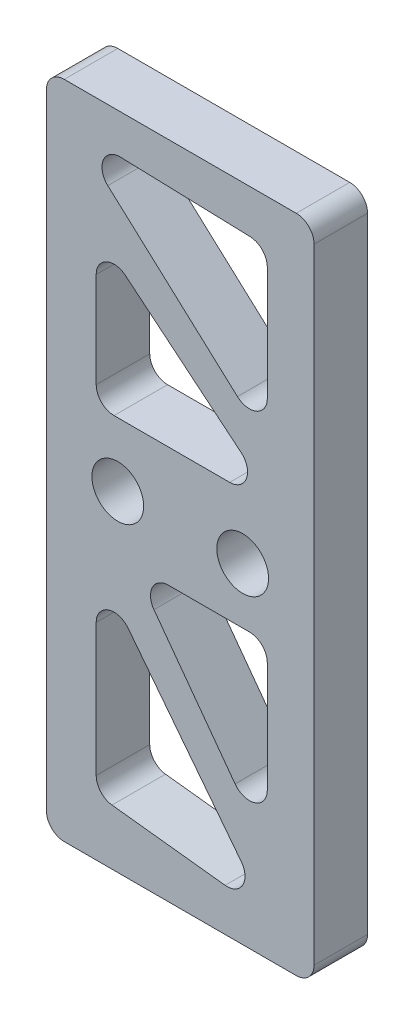
from build123d import *

# Parameters (mm, degrees)
SKETCH_1_W          = 15
SKETCH_1_H          = 37
SKETCH_1_R          = 1.45
EXTRUDE_1_DEPTH     = 3
CUT_EXTRUDE_1_DEPTH = 10
FILLET_3_R          = 1


with BuildPart() as part:
    # 草图1 → 凸台-拉伸1 (new body)
    with BuildSketch(Plane.XY):
        with Locations((7.5, 18.5)):
            Rectangle(SKETCH_1_W, SKETCH_1_H)
        with Locations((4, 18.5)):
            Circle(SKETCH_1_R, mode=Mode.SUBTRACT)
        with Locations((11, 18.5)):
            Circle(SKETCH_1_R, mode=Mode.SUBTRACT)
    extrude(amount=EXTRUDE_1_DEPTH)

    # 草图2 → 切除-拉伸1 (cut)
    with BuildSketch(Plane.XY.offset(3)):
        Polygon((1.434880502, 34.882599316), (12.379202278, 34.543765824), (12.379202278, 24.936066313), align=None)
        Polygon((2.790214468, 30.545530624), (2.790214468, 22.074693336), (13.056869261, 22.074693336), align=None)
        Polygon((4.857098766, 15.365790203), (12.379202278, 15.365790203), (12.379202278, 5.133018759), align=None)
        Polygon((2.790214468, 14.450939776), (2.790214468, 3.215813333), (12.379202278, 2.117400684), align=None)
    extrude(amount=-CUT_EXTRUDE_1_DEPTH, mode=Mode.SUBTRACT)

    # 圆角3
    fillet_3_edges = [part.edges().sort_by_distance(p)[0] for p in [
        (2.790214468, 30.545530624, 1.5),
        (13.056869261, 22.074693336, 1.5),
        (2.790214468, 22.074693336, 1.5),
        (12.379202278, 5.133018759, 1.5),
        (4.857098766, 15.365790203, 1.5),
        (12.379202278, 15.365790203, 1.5),
        (2.790214468, 14.450939776, 1.5),
        (12.379202278, 2.117400684, 1.5),
        (2.790214468, 3.215813333, 1.5),
        (12.379202278, 24.936066313, 1.5),
        (1.434880502, 34.882599316, 1.5),
        (12.379202278, 34.543765824, 1.5),
        (0, 37, 1.5),
        (15, 37, 1.5),
        (15, 0, 1.5),
        (0, 0, 1.5),
    ]]
    fillet(fillet_3_edges, radius=FILLET_3_R)


solid = part.part
